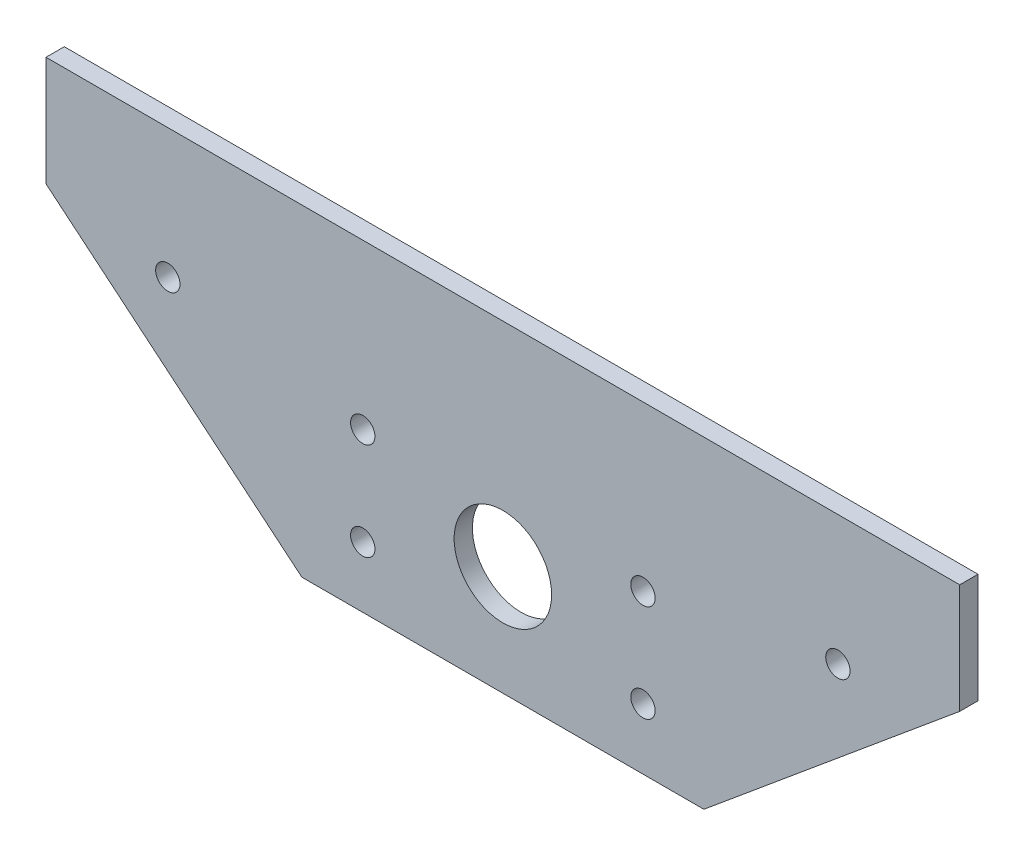
from build123d import *

# Parameters (mm, degrees)
SKETCH_1_W          = 150
SKETCH_1_H          = 70
EXTRUDE_1_DEPTH     = 3
SKETCH_2_R          = 8
CUT_EXTRUDE_1_DEPTH = 83.853269287
SKETCH_3_R          = 2
CUT_EXTRUDE_2_DEPTH = 83.853269287
SKETCH_4_R          = 2
CUT_EXTRUDE_3_DEPTH = 83.853269287
CUT_EXTRUDE_4_DEPTH = 83.853269287


with BuildPart() as part:
    # 스케치1 → 보스-돌출1 (new body)
    with BuildSketch(Plane.XY):
        with Locations((0, -0.080824272)):
            Rectangle(SKETCH_1_W, SKETCH_1_H)
    extrude(amount=EXTRUDE_1_DEPTH)

    # 스케치2 → 컷-돌출1 (cut, through all)
    with BuildSketch(Plane.XY.offset(3)):
        Circle(SKETCH_2_R)
    extrude(amount=-CUT_EXTRUDE_1_DEPTH, mode=Mode.SUBTRACT)

    # 스케치3 → 컷-돌출2 (cut, through all)
    with BuildSketch(Plane.XY.offset(3)):
        with Locations((-23, 8)):
            Circle(SKETCH_3_R)
        with Locations(Location((-23, -8, 0), (0, 0, 180))):
            Circle(SKETCH_3_R)
        with Locations((23, -8)):
            Circle(SKETCH_3_R)
        with Locations(Location((23, 8, 0), (0, 0, 180))):
            Circle(SKETCH_3_R)
    extrude(amount=-CUT_EXTRUDE_2_DEPTH, mode=Mode.SUBTRACT)

    # 스케치4 → 컷-돌출3 (cut, through all)
    with BuildSketch(Plane.XY.offset(3)):
        with Locations((-55, 13.64900919)):
            Circle(SKETCH_4_R)
        with Locations((-65, -25.080824272)):
            Circle(SKETCH_4_R)
        with Locations(Location((65, -25.080824272, 0), (0, 0, 180))):
            Circle(SKETCH_4_R)
        with Locations(Location((55, 13.64900919, 0), (0, 0, 180))):
            Circle(SKETCH_4_R)
    extrude(amount=-CUT_EXTRUDE_3_DEPTH, mode=Mode.SUBTRACT)

    # 스케치5 → 컷-돌출4 (cut, through all)
    with BuildSketch(Plane.XY.offset(3)):
        Polygon((-75, 16.919175728), (-33, -18), (33, -18), (75, 16.919175728), (75, -35.080824272), (-75, -35.080824272), (-75, -27.080824272), align=None)
    extrude(amount=-CUT_EXTRUDE_4_DEPTH, mode=Mode.SUBTRACT)


solid = part.part
